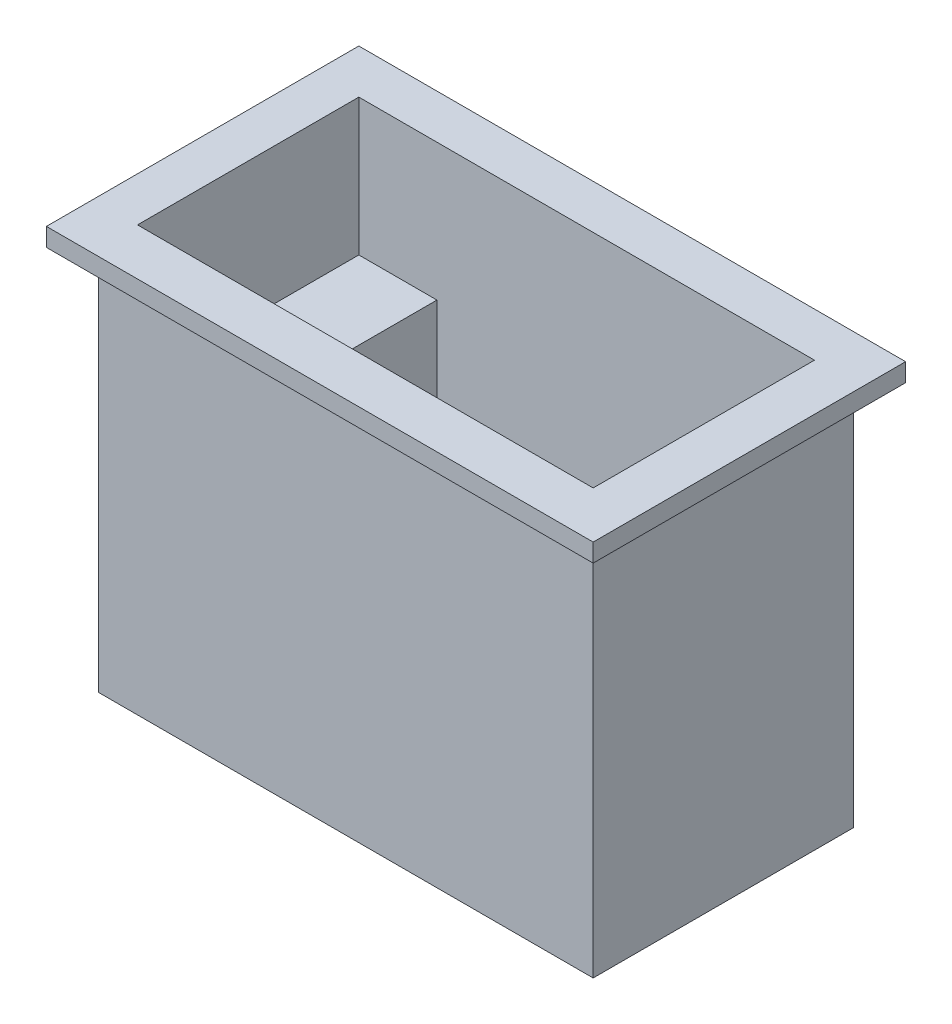
from build123d import *

# Parameters (mm, degrees)
SKETCH1_W           = 38
SKETCH1_H           = 20
BOSS_EXTRUDE1_DEPTH = 31
SKETCH2_W           = 35
SKETCH2_H           = 17
CUT_EXTRUDE1_DEPTH  = 28
SKETCH3_W           = 6
SKETCH3_H           = 17
BOSS_EXTRUDE2_DEPTH = 17.5
SKETCH4_W           = 42
SKETCH4_H           = 24
SKETCH4_W_2         = 38
SKETCH4_H_2         = 20
EXTRUDE_THIN2_DEPTH = 1.4
SKETCH5_R           = 1
CUT_EXTRUDE2_DEPTH  = 3
SKETCH6_R           = 1
CUT_EXTRUDE3_DEPTH  = 3
SKETCH7_W           = 8
SKETCH7_H           = 3
CUT_EXTRUDE4_DEPTH  = 10
SKETCH8_W           = 18
SKETCH8_H           = 9
CUT_EXTRUDE5_DEPTH  = 2
SKETCH9_R           = 3.725
SKETCH9_R_2         = 0.7
CUT_EXTRUDE6_DEPTH  = 4
FILLET1_R           = 4


with BuildPart() as part:
    # Sketch1 → Boss-Extrude1 (new body)
    with BuildSketch(Plane(origin=(0, 0, 0), x_dir=(1, 0, 0), z_dir=(0, 1, 0))):
        with Locations((8.6, -4.057142857)):
            Rectangle(SKETCH1_W, SKETCH1_H)
    extrude(amount=BOSS_EXTRUDE1_DEPTH)

    # Sketch2 → Cut-Extrude1 (cut)
    with BuildSketch(Plane(origin=(0, 31, 0), x_dir=(1, 0, 0), z_dir=(0, 1, 0))):
        with Locations((8.5, -3.957142857)):
            Rectangle(SKETCH2_W, SKETCH2_H)
    extrude(amount=-CUT_EXTRUDE1_DEPTH, mode=Mode.SUBTRACT)

    # Sketch3 → Boss-Extrude2 (add)
    with BuildSketch(Plane(origin=(0, 3, 0), x_dir=(1, 0, 0), z_dir=(0, 1, 0))):
        with Locations((-6, -3.957142857)):
            Rectangle(SKETCH3_W, SKETCH3_H)
        with Locations((23, -3.957142857)):
            Rectangle(SKETCH3_W, SKETCH3_H)
    extrude(amount=BOSS_EXTRUDE2_DEPTH)

    # Sketch4 → Extrude-Thin2 (add)
    with BuildSketch(Plane(origin=(0, 31, 0), x_dir=(1, 0, 0), z_dir=(0, 1, 0))):
        with Locations((8.6, -4.057142857)):
            Rectangle(SKETCH4_W, SKETCH4_H)
        with Locations((8.6, -4.057142857)):
            Rectangle(SKETCH4_W_2, SKETCH4_H_2, mode=Mode.SUBTRACT)
    extrude(amount=-EXTRUDE_THIN2_DEPTH)

    # Sketch5 → Cut-Extrude2 (cut)
    with BuildSketch(Plane(origin=(0, 20.5, 0), x_dir=(1, 0, 0), z_dir=(0, 1, 0))):
        with Locations(Location((-5.5, -3.892148731, 0), (0, 0, 270))):
            Circle(SKETCH5_R)
    extrude(amount=-CUT_EXTRUDE2_DEPTH, mode=Mode.SUBTRACT)

    # Sketch6 → Cut-Extrude3 (cut)
    with BuildSketch(Plane(origin=(0, 20.5, 0), x_dir=(1, 0, 0), z_dir=(0, 1, 0))):
        with Locations(Location((22.953148274, -4.115727136, 0), (0, 0, 270))):
            Circle(SKETCH6_R)
    extrude(amount=-CUT_EXTRUDE3_DEPTH, mode=Mode.SUBTRACT)

    # Sketch7 → Cut-Extrude4 (cut)
    with BuildSketch(Plane(origin=(-3, 0, 0), x_dir=(0, 0, -1), z_dir=(1, 0, 0))):
        with Locations((-5.039117413, 5.541369126)):
            Rectangle(SKETCH7_W, SKETCH7_H)
    extrude(amount=-CUT_EXTRUDE4_DEPTH, mode=Mode.SUBTRACT)

    # Sketch8 → Cut-Extrude5 (cut)
    with BuildSketch(Plane(origin=(0, 3, 0), x_dir=(1, 0, 0), z_dir=(0, 1, 0))):
        with Locations((8.91134377, -3.084544202)):
            Rectangle(SKETCH8_W, SKETCH8_H)
    extrude(amount=-CUT_EXTRUDE5_DEPTH, mode=Mode.SUBTRACT)

    # Sketch9 → Cut-Extrude6 (cut)
    with BuildSketch(Plane(origin=(0, 1, 0), x_dir=(1, 0, 0), z_dir=(0, 1, 0))):
        with Locations(Location((8.68865623, -3.170580553, 0), (0, 0, 270))):
            Circle(SKETCH9_R)
        with Locations(Location((1.96365623, -3.170580553, 0), (0, 0, 270))):
            Circle(SKETCH9_R_2)
        with Locations(Location((15.41365623, -3.170580553, 0), (0, 0, 270))):
            Circle(SKETCH9_R_2)
    extrude(amount=-CUT_EXTRUDE6_DEPTH, mode=Mode.SUBTRACT)

    # Fillet1
    fillet1_edges = [part.edges().sort_by_distance(p)[0] for p in [
        (-0.08865623, 2, 7.584544202),
        (-0.08865623, 2, -1.415455798),
        (17.91134377, 2, -1.415455798),
        (17.91134377, 2, 7.584544202),
    ]]
    fillet(fillet1_edges, radius=FILLET1_R)


solid = part.part
